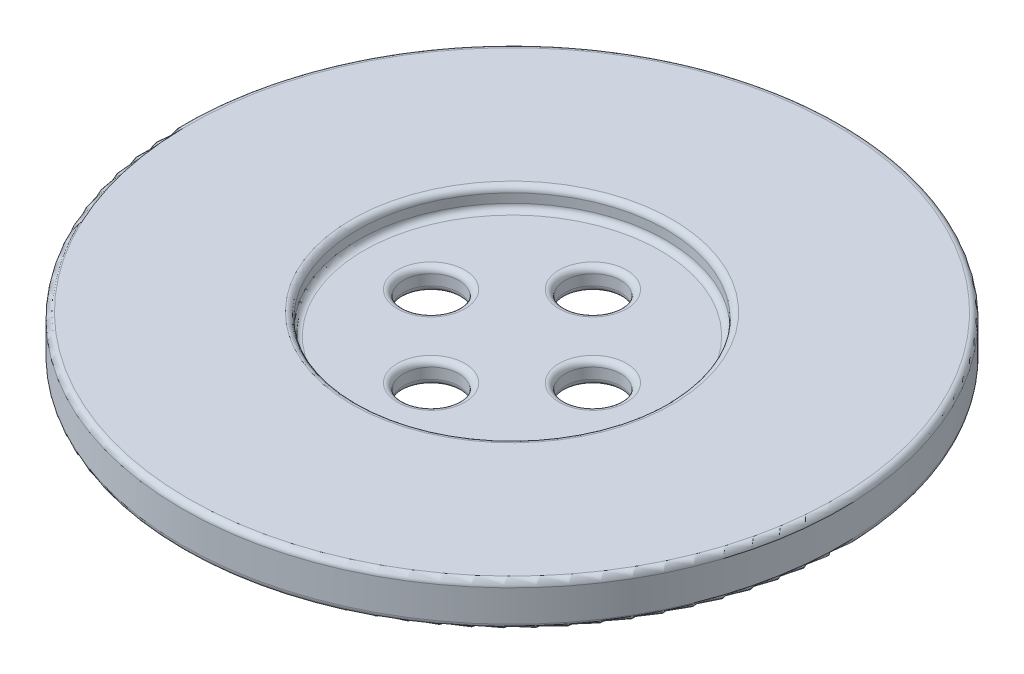
from build123d import *

# Parameters (mm, degrees)
SKETCH1_R           = 22
SKETCH1_R_2         = 1.85
BOSS_EXTRUDE1_DEPTH = 2.9
SKETCH2_R           = 10.3
CUT_EXTRUDE1_DEPTH  = 1.4
FILLET1_R           = 0.4


with BuildPart() as part:
    # Sketch1 → Boss-Extrude1 (new body)
    with BuildSketch(Plane(origin=(0, 0, 0), x_dir=(1, 0, 0), z_dir=(0, 1, 0))):
        with Locations(Location((0, 0, 0), (0, 0, 270))):
            Circle(SKETCH1_R)
        with Locations(Location((0, 5.4, 0), (0, 0, 270))):
            Circle(SKETCH1_R_2, mode=Mode.SUBTRACT)
        with Locations(Location((5.4, 0, 0), (0, 0, 270))):
            Circle(SKETCH1_R_2, mode=Mode.SUBTRACT)
        with Locations(Location((0, -5.4, 0), (0, 0, 270))):
            Circle(SKETCH1_R_2, mode=Mode.SUBTRACT)
        with Locations(Location((-5.4, 0, 0), (0, 0, 270))):
            Circle(SKETCH1_R_2, mode=Mode.SUBTRACT)
    extrude(amount=BOSS_EXTRUDE1_DEPTH)

    # Sketch2 → Cut-Extrude1 (cut)
    with BuildSketch(Plane(origin=(0, 2.9, 0), x_dir=(1, 0, 0), z_dir=(0, 1, 0))):
        with Locations(Location((0, 0, 0), (0, 0, 270))):
            Circle(SKETCH2_R)
    extrude(amount=-CUT_EXTRUDE1_DEPTH, mode=Mode.SUBTRACT)

    # Fillet1
    fillet1_edges = [part.edges().sort_by_distance(p)[0] for p in [
        (0, 0, 3.55),
        (-5.4, 0, -1.85),
        (0, 0, -22),
        (0, 1.5, -10.3),
        (0, 1.5, -7.25),
        (5.4, 1.5, -1.85),
        (0, 1.5, 3.55),
        (-5.4, 1.5, -1.85),
        (0, 2.9, -10.3),
        (0, 2.9, -22),
        (0, 0, -7.25),
        (5.4, 0, -1.85),
    ]]
    fillet(fillet1_edges, radius=FILLET1_R)


solid = part.part
